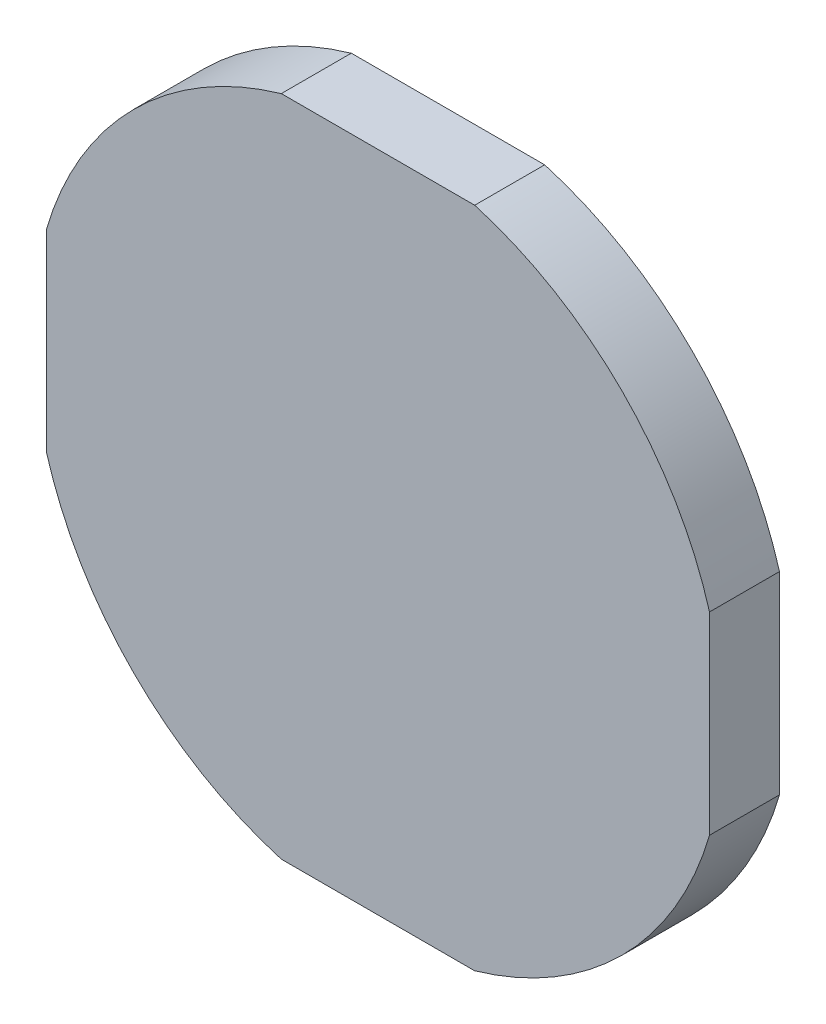
from build123d import *

# Parameters (mm, degrees)
BOSS_EXTRUDE1_DEPTH = 0.9652
SKETCH2_W           = 1.25
SKETCH2_H           = 2.5
CUT_EXTRUDE1_DEPTH  = 0.0254


with BuildPart() as part:
    # Sketch1 → Boss-Extrude1 (new body)
    with BuildSketch(Plane.XY):
        with BuildLine():
            Line((-1.3335, 4.572), (1.3335, 4.572))
            ThreePointArc((1.3335, 4.572), (3.367596045, 3.367596045), (4.572, 1.3335))
            Line((4.572, 1.3335), (4.572, -1.3335))
            ThreePointArc((4.572, -1.3335), (3.367596045, -3.367596045), (1.3335, -4.572))
            Line((1.3335, -4.572), (-1.3335, -4.572))
            ThreePointArc((-1.3335, -4.572), (-3.367596045, -3.367596045), (-4.572, -1.3335))
            Line((-4.572, -1.3335), (-4.572, 1.3335))
            ThreePointArc((-4.572, 1.3335), (-3.367596045, 3.367596045), (-1.3335, 4.572))
        make_face()
    extrude(amount=-BOSS_EXTRUDE1_DEPTH)

    # Sketch2 → Cut-Extrude1 (cut)
    with BuildSketch(Plane(origin=(0, 0, -0.9652), x_dir=(-1, 0, 0), z_dir=(0, 0, -1))):
        with Locations((-2, 1.875)):
            Rectangle(SKETCH2_W, SKETCH2_H)
        with Locations((0, 1.875)):
            Rectangle(SKETCH2_W, SKETCH2_H)
        with Locations((2, 1.875)):
            Rectangle(SKETCH2_W, SKETCH2_H)
        with Locations((-2, -1.875)):
            Rectangle(SKETCH2_W, SKETCH2_H)
        with Locations((0, -1.875)):
            Rectangle(SKETCH2_W, SKETCH2_H)
        with Locations((2, -1.875)):
            Rectangle(SKETCH2_W, SKETCH2_H)
    extrude(amount=-CUT_EXTRUDE1_DEPTH, mode=Mode.SUBTRACT)


solid = part.part
